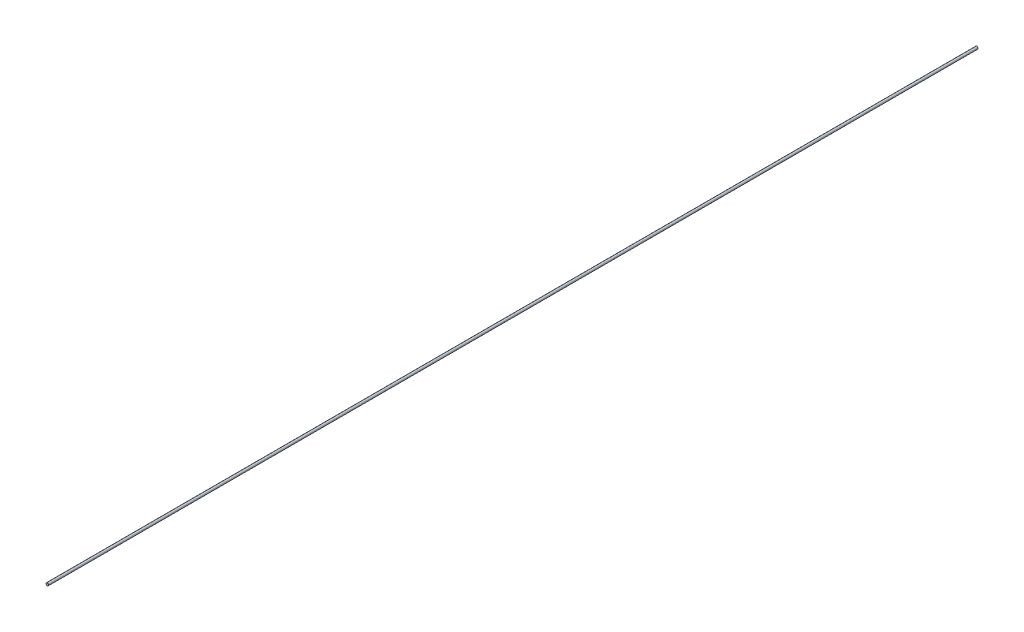
from build123d import *

# Parameters (mm, degrees)
BOSS_EXTRUDE1_DEPTH      = 914.4
BOSS_EXTRUDE1_DEPTH_BACK = 914.4
SKETCH3_R                = 2.5


with BuildPart() as part:
    # Sketch3 → Boss-Extrude1 (new, two sides: drawn at the far end of the back side and taken through both)
    with BuildSketch(Plane.XY.offset(-BOSS_EXTRUDE1_DEPTH_BACK)):
        with Locations(Location((0, 0, 0), (0, 0, 180))):
            Circle(SKETCH3_R)
    extrude(amount=BOSS_EXTRUDE1_DEPTH + BOSS_EXTRUDE1_DEPTH_BACK)


solid = part.part
